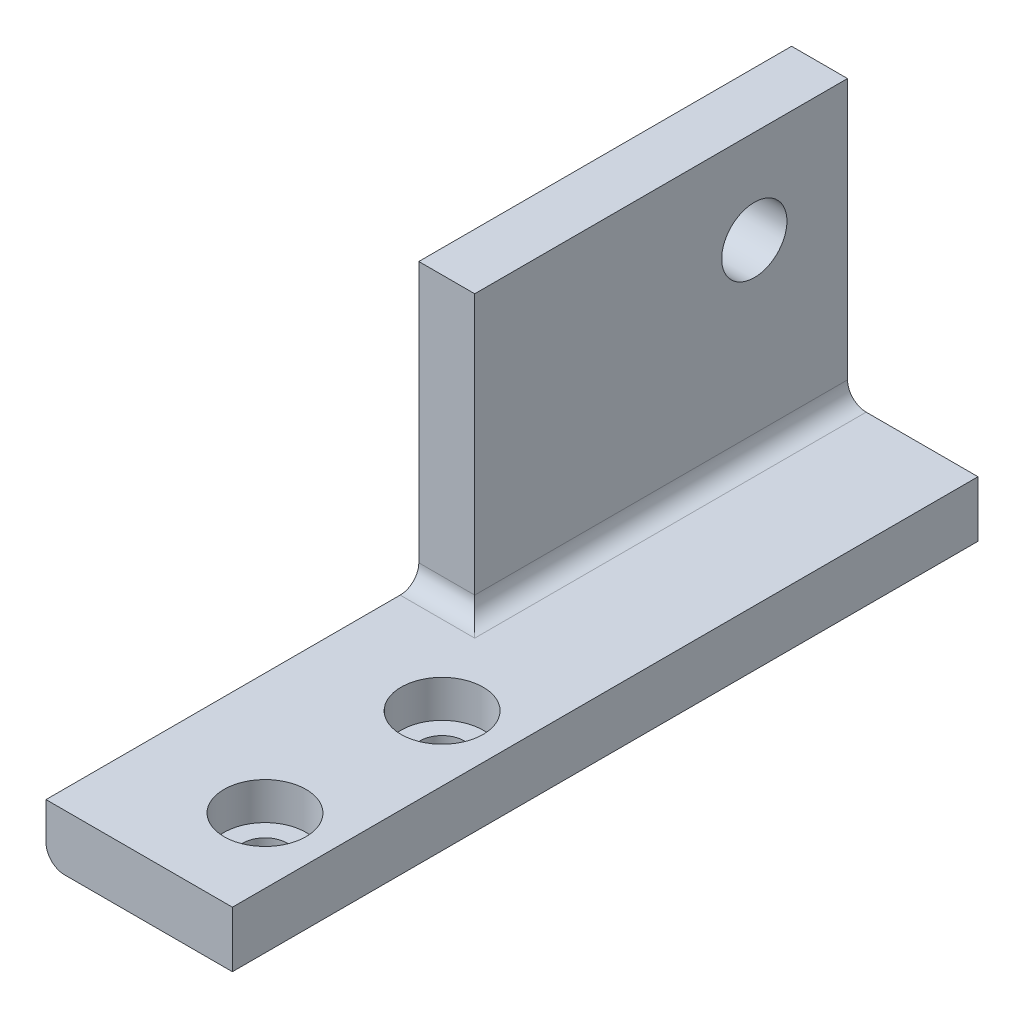
from build123d import *

# Parameters (mm, degrees)
SKETCH1_W                      = 10
SKETCH1_H                      = 20
SKETCH1_R                      = 1.175
BOSS_EXTRUDE1_DEPTH            = 3
CBORE_FOR_M2_SHCS1_D           = 2.4
CBORE_FOR_M2_SHCS1_CBORE_D     = 4.4
CBORE_FOR_M2_SHCS1_CBORE_DEPTH = 2
SKETCH6_W                      = 10
SKETCH6_H                      = 3
BOSS_EXTRUDE2_DEPTH            = 20
SKETCH8_W                      = 3
SKETCH8_H                      = 20
BOSS_EXTRUDE3_DEPTH            = 15
SKETCH9_R                      = 1.75
CUT_EXTRUDE1_DEPTH             = 45.418464629
FILLET1_R                      = 1
FILLET2_R                      = 1


with BuildPart() as part:
    # Sketch1 → Boss-Extrude1 (new body)
    with BuildSketch(Plane(origin=(0, 0, 0), x_dir=(1, 0, 0), z_dir=(0, 1, 0))):
        with Locations((5, 10)):
            Rectangle(SKETCH1_W, SKETCH1_H)
        with Locations(Location((6.5, 5.25, 0), (0, 0, 270))):
            Circle(SKETCH1_R, mode=Mode.SUBTRACT)
        with Locations(Location((6.5, 14.75, 0), (0, 0, 270))):
            Circle(SKETCH1_R, mode=Mode.SUBTRACT)
    extrude(amount=BOSS_EXTRUDE1_DEPTH)

    # CBORE for M2 SHCS1 (through all)
    with Locations(Plane(origin=(0, 3, 0), x_dir=(1, 0, 0), z_dir=(0, 1, 0))):
        with Locations((6.5, 14.75), (6.5, 5.25)):
            CounterBoreHole(CBORE_FOR_M2_SHCS1_D / 2, CBORE_FOR_M2_SHCS1_CBORE_D / 2, CBORE_FOR_M2_SHCS1_CBORE_DEPTH)

    # Sketch6 → Boss-Extrude2 (add)
    with BuildSketch(Plane(origin=(0, 0, -20), x_dir=(-1, 0, 0), z_dir=(0, 0, -1))):
        with Locations((-5, 1.5)):
            Rectangle(SKETCH6_W, SKETCH6_H)
    extrude(amount=BOSS_EXTRUDE2_DEPTH)

    # Sketch8 → Boss-Extrude3 (add)
    with BuildSketch(Plane(origin=(0, 3, 0), x_dir=(1, 0, 0), z_dir=(0, 1, 0))):
        with Locations((1.5, 30)):
            Rectangle(SKETCH8_W, SKETCH8_H)
    extrude(amount=BOSS_EXTRUDE3_DEPTH)

    # Sketch9 → Cut-Extrude1 (cut, through all)
    with BuildSketch(Plane(origin=(3, 0, 0), x_dir=(0, 0, -1), z_dir=(1, 0, 0))):
        with Locations((35, 13)):
            Circle(SKETCH9_R)
    extrude(amount=-CUT_EXTRUDE1_DEPTH, mode=Mode.SUBTRACT)

    # Fillet1
    fillet1_edges = [part.edges().sort_by_distance(p)[0] for p in [
        (1.5, 3, -20),
        (3, 3, -30),
    ]]
    fillet(fillet1_edges, radius=FILLET1_R)

    # Fillet2
    fillet2_edges = [part.edges().sort_by_distance(p)[0] for p in [
        (0, 0, -20),
    ]]
    fillet(fillet2_edges, radius=FILLET2_R)


solid = part.part
